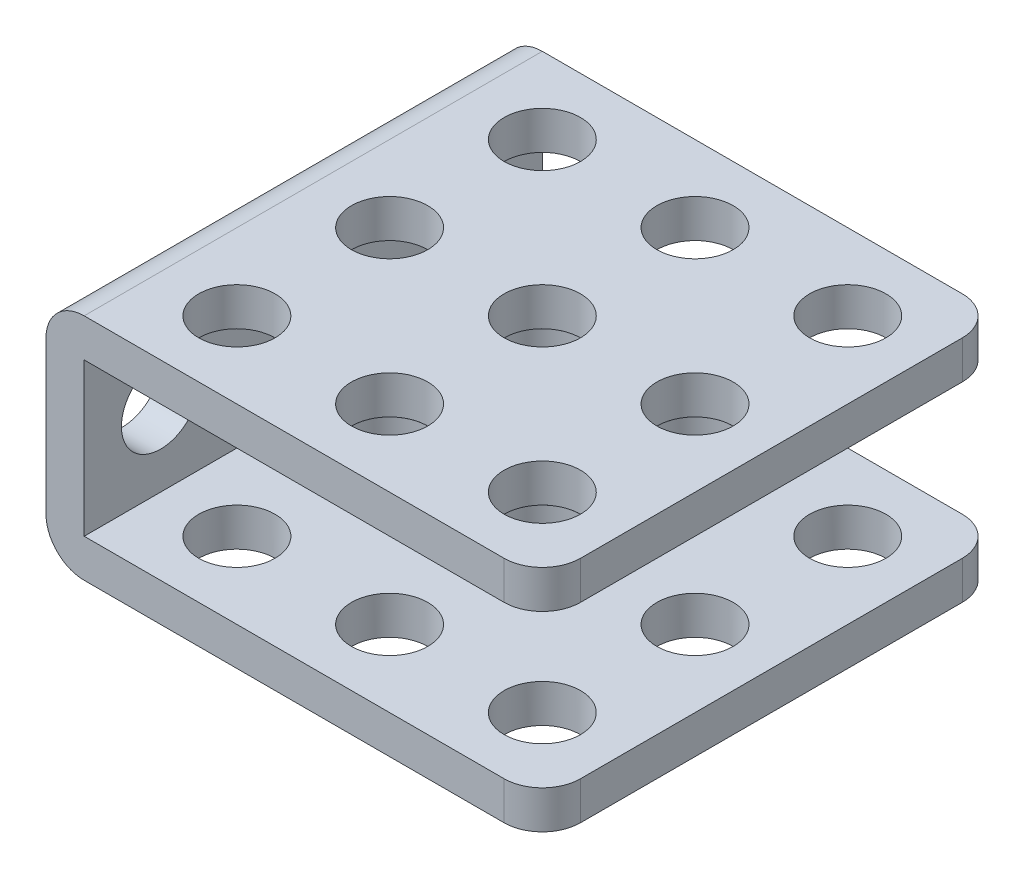
from build123d import *

# Parameters (mm, degrees)
BOSS_EXTRUDE1_DEPTH  = 24
SKETCH2_R            = 2.05
CUT_EXTRUDE1_DEPTH   = 37
LPATTERN1_COUNT      = 3
LPATTERN1_PITCH      = 8
SKETCH3_R            = 2
CUT_EXTRUDE2_DEPTH   = 37.769552622
LPATTERN2_COUNT      = 3
LPATTERN2_PITCH      = 8
LPATTERN2_COUNT_DIR2 = 3
LPATTERN2_PITCH_DIR2 = 8
FILLET1_R            = 2


with BuildPart() as part:
    # Sketch1 → Boss-Extrude1 (new body)
    with BuildSketch(Plane.XY):
        Polygon((0, 0), (0, 10), (0, 12), (26, 12), (26, 10), (2, 10), (2, 2), (26, 2), (26, 0), align=None)
    extrude(amount=BOSS_EXTRUDE1_DEPTH)

    # Sketch2 → Cut-Extrude1 (cut, through all)
    with BuildSketch(Plane(origin=(2, 0, 0), x_dir=(0, 0, -1), z_dir=(1, 0, 0))):
        with Locations(Location((-20, 6, 0), (0, 0, 90))):
            Circle(SKETCH2_R)
    cut_extrude1 = extrude(amount=-CUT_EXTRUDE1_DEPTH, mode=Mode.SUBTRACT)

    # LPattern1: Cut-Extrude1 ×3
    with Locations(*[(0, 0, -i * LPATTERN1_PITCH) for i in range(1, LPATTERN1_COUNT)]):
        add(cut_extrude1, mode=Mode.SUBTRACT)

    # Sketch3 → Cut-Extrude2 (cut, symmetric)
    with BuildSketch(Plane(origin=(0, 2, 0), x_dir=(1, 0, 0), z_dir=(0, 1, 0))):
        with Locations(Location((22, -4, 0), (0, 0, 270))):
            Circle(SKETCH3_R)
    cut_extrude2 = extrude(amount=CUT_EXTRUDE2_DEPTH, both=True, mode=Mode.SUBTRACT)

    # LPattern2: Cut-Extrude2 3 × 3
    with Locations(*[(-j * LPATTERN2_PITCH_DIR2, 0, i * LPATTERN2_PITCH) for i in range(LPATTERN2_COUNT) for j in range(LPATTERN2_COUNT_DIR2) if (i, j) != (0, 0)]):
        add(cut_extrude2, mode=Mode.SUBTRACT)

    # Fillet1
    fillet1_edges = [part.edges().sort_by_distance(p)[0] for p in [
        (26, 1, 0),
        (0, 0, 12),
        (0, 12, 12),
        (26, 11, 24),
        (26, 1, 24),
        (26, 11, 0),
    ]]
    fillet(fillet1_edges, radius=FILLET1_R)


solid = part.part
